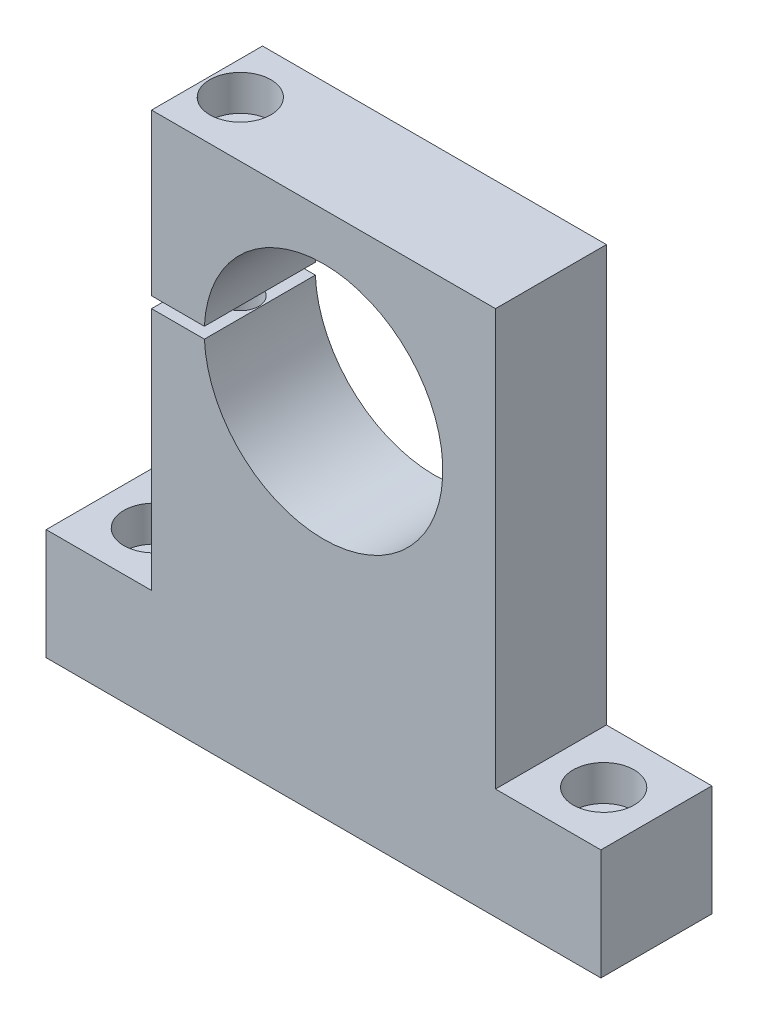
from build123d import *

# Parameters (mm, degrees)
SCHIZZO1_R                                           = 21.5
ESTRUSIONE_ESTRUSIONE1_DEPTH                         = 20
FORO_LAMATO_PER_VITE_M6_A_TESTA_CILINDRI_D           = 6.6
FORO_LAMATO_PER_VITE_M6_A_TESTA_CILINDRI_CBORE_D     = 11
FORO_LAMATO_PER_VITE_M6_A_TESTA_CILINDRI_CBORE_DEPTH = 6.4
FORO_LAMATO_PER_VITE_M6_A_TESTA_CILI_2_D             = 6.6
FORO_LAMATO_PER_VITE_M6_A_TESTA_CILI_2_CBORE_D       = 11
FORO_LAMATO_PER_VITE_M6_A_TESTA_CILI_2_CBORE_DEPTH   = 6.4
SCHIZZO7_W                                           = 15.52137419
SCHIZZO7_H                                           = 2
TAGLIO_ESTRUSIONE1_DEPTH                             = 140.373598648


with BuildPart() as part:
    # Schizzo1 → Estrusione-Estrusione1 (new body)
    with BuildSketch(Plane.XY):
        Polygon((0, 0), (100, 0), (100, 20), (81, 20), (81, 95), (19, 95), (19, 20), (0, 20), align=None)
        with Locations((50, 65)):
            Circle(SCHIZZO1_R, mode=Mode.SUBTRACT)
    extrude(amount=ESTRUSIONE_ESTRUSIONE1_DEPTH)

    # Foro lamato per Vite M6 a testa cilindri (through all)
    with Locations(Plane(origin=(9.5, 20, 10), x_dir=(0, 0, 1), z_dir=(0, 1, 0))):
        with Locations((0, 0), (0, 81)):
            CounterBoreHole(FORO_LAMATO_PER_VITE_M6_A_TESTA_CILINDRI_D / 2, FORO_LAMATO_PER_VITE_M6_A_TESTA_CILINDRI_CBORE_D / 2, FORO_LAMATO_PER_VITE_M6_A_TESTA_CILINDRI_CBORE_DEPTH)

    # Foro lamato per Vite M6 a testa cili 2 (through all)
    with Locations(Plane(origin=(25, 95, 10), x_dir=(0, 0, 1), z_dir=(0, 1, 0))):
        with Locations((0, 0)):
            CounterBoreHole(FORO_LAMATO_PER_VITE_M6_A_TESTA_CILI_2_D / 2, FORO_LAMATO_PER_VITE_M6_A_TESTA_CILI_2_CBORE_D / 2, FORO_LAMATO_PER_VITE_M6_A_TESTA_CILI_2_CBORE_DEPTH)

    # Schizzo7 → Taglio-Estrusione1 (cut, through all)
    with BuildSketch(Plane(origin=(0, 0, 0), x_dir=(-1, 0, 0), z_dir=(0, 0, -1))):
        with Locations((-23.66540179, 65)):
            Rectangle(SCHIZZO7_W, SCHIZZO7_H)
    extrude(amount=-TAGLIO_ESTRUSIONE1_DEPTH, mode=Mode.SUBTRACT)


solid = part.part
